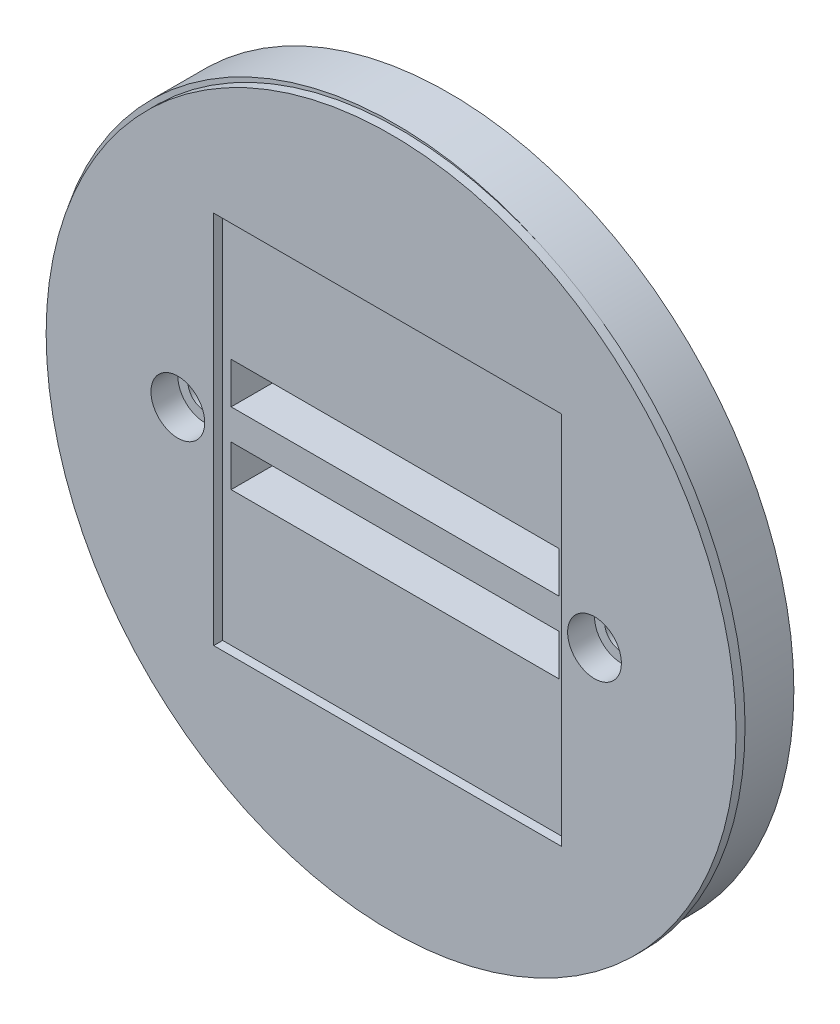
from build123d import *

# Parameters (mm, degrees)
SKETCH1_R                  = 38.5
SKETCH1_R_2                = 1.875
SKETCH1_W                  = 36.6
SKETCH1_H                  = 4.6
MAIN_FLANGE_COUPLING_DEPTH = 6
SKETCH2_R                  = 38.5
SKETCH2_R_2                = 1.65
SKETCH2_W                  = 38.8
SKETCH2_H                  = 41.8
BOSS_EXTRUDE1_DEPTH        = 1
SKETCH3_R                  = 3
CUT_EXTRUDE1_DEPTH         = 3


with BuildPart() as part:
    # Sketch1 → Main Flange Coupling (new body)
    with BuildSketch(Plane.XY):
        Circle(SKETCH1_R)
        with Locations((-23.25, 0)):
            Circle(SKETCH1_R_2, mode=Mode.SUBTRACT)
        with Locations(Location((23.25, 0, 0), (0, 0, 180))):
            Circle(SKETCH1_R_2, mode=Mode.SUBTRACT)
        with Locations((0, 4.3)):
            Rectangle(SKETCH1_W, SKETCH1_H, mode=Mode.SUBTRACT)
        with Locations((0, -3.7)):
            Rectangle(SKETCH1_W, SKETCH1_H, mode=Mode.SUBTRACT)
    extrude(amount=-MAIN_FLANGE_COUPLING_DEPTH)

    # Sketch2 → Boss-Extrude1 (add)
    with BuildSketch(Plane.XY):
        with Locations(Location((0.55, -0.25, 0), (0, 0, 245.106490258))):
            Circle(SKETCH2_R)
        with Locations((-23.25, 0)):
            Circle(SKETCH2_R_2, mode=Mode.SUBTRACT)
        with Locations((23.25, 0)):
            Circle(SKETCH2_R_2, mode=Mode.SUBTRACT)
        with Locations((0.15, -0.15)):
            Rectangle(SKETCH2_W, SKETCH2_H, mode=Mode.SUBTRACT)
    extrude(amount=BOSS_EXTRUDE1_DEPTH)

    # Sketch3 → Cut-Extrude1 (cut)
    with BuildSketch(Plane.XY.offset(1)):
        with Locations((-23.25, 0)):
            Circle(SKETCH3_R)
        with Locations((23.25, 0)):
            Circle(SKETCH3_R)
    extrude(amount=-CUT_EXTRUDE1_DEPTH, mode=Mode.SUBTRACT)


solid = part.part
